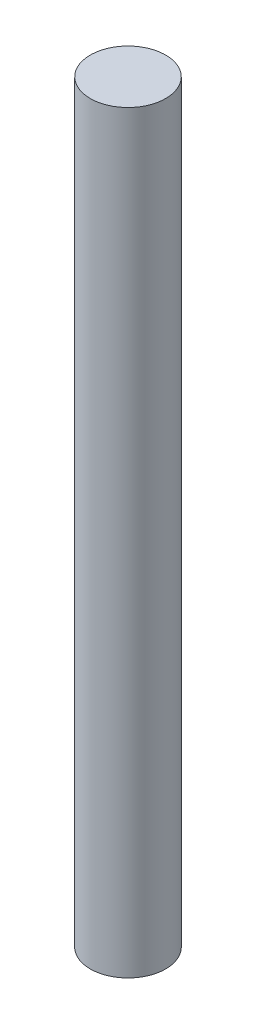
from build123d import *

# Parameters (mm, degrees)
SKETCH1_R           = 5
BOSS_EXTRUDE1_DEPTH = 100


with BuildPart() as part:
    # Sketch1 → Boss-Extrude1 (new body)
    with BuildSketch(Plane(origin=(0, 0, 0), x_dir=(1, 0, 0), z_dir=(0, 1, 0))):
        with Locations(Location((0, 0, 0), (0, 0, 270))):
            Circle(SKETCH1_R)
    extrude(amount=BOSS_EXTRUDE1_DEPTH)


solid = part.part
